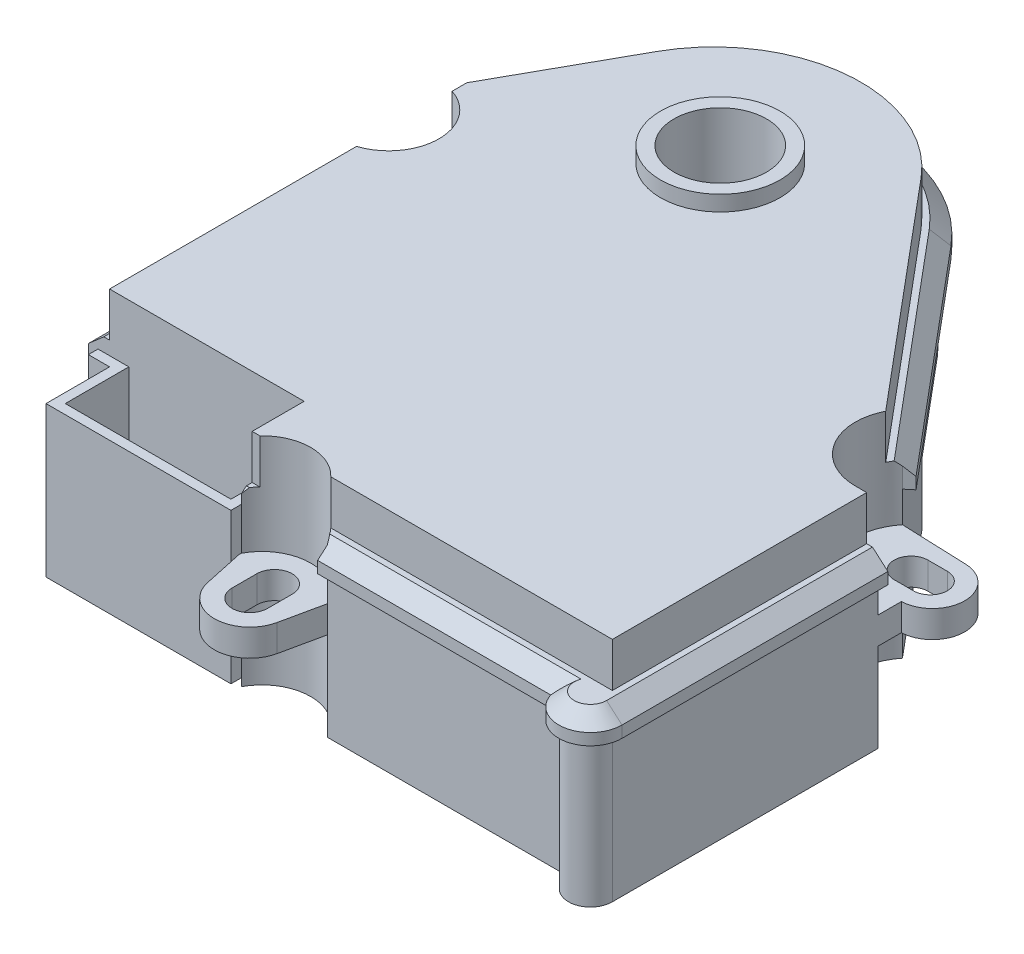
from build123d import *
from OCP.BRepFilletAPI import BRepFilletAPI_MakeChamfer

# Parameters (mm, degrees)
BOSS_EXTRUDE1_DEPTH  = 28
BOSS_EXTRUDE2_DEPTH  = 30
BOSS_EXTRUDE3_START  = -6
BOSS_EXTRUDE3_DEPTH  = 6
CUT_EXTRUDE1_DEPTH   = 8
CUT_EXTRUDE2_DEPTH   = 76.67816726110647
BOSS_EXTRUDE4_START  = -13
BOSS_EXTRUDE4_DEPTH  = 3.5
CUT_EXTRUDE4_DEPTH   = 76.67816726110647
BOSS_EXTRUDE5_START  = -13
SKETCH3_3_R          = 2.599999999999996
BOSS_EXTRUDE5_DEPTH  = 3.5
CUT_EXTRUDE5_DEPTH   = 76.67816726110647
BOSS_EXTRUDE6_START  = -13
BOSS_EXTRUDE6_DEPTH  = 3.5
CUT_EXTRUDE6_DEPTH   = 5.75
BOSS_EXTRUDE8_DEPTH  = 3.25
CHAMFER1_SIZE        = 1.75
CHAMFER1_SIZE2       = 2
BOSS_EXTRUDE9_DEPTH  = 12.5
SKETCH9_R            = 5.999999999999998
SKETCH9_R_2          = 5.000000000000008
BOSS_EXTRUDE10_DEPTH = 5
BOSS_EXTRUDE11_DEPTH = 25
CUT_EXTRUDE7_START   = 20.5
SKETCH10_3_W         = 2.749999999999993
SKETCH10_3_H         = 1.25
SKETCH10_3_W_2       = 1.25
CUT_EXTRUDE7_DEPTH   = 7.5
SKETCH10_4_W         = 1.25
SKETCH10_4_H         = 1.25
CUT_EXTRUDE8_DEPTH   = 78.13266949990349
SKETCH11_W           = 24
SKETCH11_H           = 8.25
CUT_EXTRUDE10_DEPTH  = 1
SKETCH12_W           = 21.5
SKETCH12_H           = 8.25
CUT_EXTRUDE11_DEPTH  = 15


with BuildPart() as part:
    # Sketch1 → Boss-Extrude1 (new body)
    with BuildSketch(Plane(origin=(0, 0, 0), x_dir=(1, 0, 0), z_dir=(0, 1, 0))):
        with BuildLine():
            Line((-25.662208655272856, 43.65794838986857), (-30.756279219672532, 34.5))
            Line((-30.756279219672532, 34.5), (-15.400000000000006, 34.500000000000014))
            ThreePointArc((-15.400000000000006, 34.50000000000003), (-13.130077554195768, 39.98007755419575), (-7.65000000000006, 42.25000000000003))
            Line((-7.650000000000004, 42.25000000000003), (-7.650000000000004, 54.25000000000001))
            ThreePointArc((-7.650000000000002, 54.25000000000006), (-18.097861239899487, 51.40573965924003), (-25.662208655272856, 43.65794838986857))
        make_face()
        with BuildLine():
            ThreePointArc((8.139146924334142, 46.8873998734486), (1.060698037782414, 52.31888473712936), (-7.650000000000002, 54.25000000000006))
            Line((-7.650000000000004, 54.25000000000001), (-7.650000000000004, 42.25000000000003))
            ThreePointArc((-7.65000000000006, 42.25000000000003), (-2.1699224458042794, 39.980077554195795), (0.09999999999999876, 34.50000000000003))
            Line((0.09999999999999787, 34.50000000000003), (18.533409589390377, 34.50000000000004))
            Line((18.533409589390406, 34.50000000000007), (8.139146924334142, 46.8873998734486))
        make_face()
        with BuildLine():
            Line((-30.756279219672532, 34.5), (-34.65, 27.5))
            Line((-34.65, 27.5), (-34.65, -27.5))
            Line((-34.65, -27.5), (34.649999999999984, -27.5))
            ThreePointArc((34.64999999999999, -27.5), (37.49999999999999, -30.349999999999994), (40.349999999999994, -27.5))
            Line((40.349999999999994, -27.5), (40.349999999999994, 8.499999999999993))
            Line((40.349999999999994, 8.499999999999993), (18.533409589390406, 34.50000000000007))
            Line((18.533409589390377, 34.50000000000004), (0.09999999999999787, 34.50000000000003))
            ThreePointArc((0.09999999999999876, 34.50000000000003), (-7.650000000000006, 26.750000000000025), (-15.400000000000006, 34.50000000000003))
            Line((-15.400000000000006, 34.500000000000014), (-30.756279219672532, 34.5))
        make_face()
    extrude(amount=BOSS_EXTRUDE1_DEPTH)

    # Sketch1<3> → Boss-Extrude2 (add)
    with BuildSketch(Plane(origin=(0, 0, 0), x_dir=(1, 0, 0), z_dir=(0, 1, 0))):
        with BuildLine():
            ThreePointArc((-7.65000000000006, 42.25000000000003), (-13.130077554195768, 39.98007755419575), (-15.400000000000006, 34.50000000000003))
            Line((-15.400000000000006, 34.500000000000014), (-13.650000000000002, 34.500000000000014))
            ThreePointArc((-13.650000000000002, 34.50000000000003), (-11.892640687119265, 38.742640687119334), (-7.649999999999938, 40.50000000000003))
            Line((-7.650000000000004, 40.50000000000003), (-7.650000000000004, 42.25000000000003))
        make_face()
        with BuildLine():
            ThreePointArc((0.09999999999999876, 34.50000000000003), (-2.1699224458042794, 39.980077554195795), (-7.65000000000006, 42.25000000000003))
            Line((-7.650000000000004, 42.25000000000003), (-7.650000000000004, 40.50000000000003))
            ThreePointArc((-7.649999999999937, 40.50000000000003), (-3.407359312880696, 38.74264068711929), (-1.6500000000000048, 34.50000000000003))
            Line((-1.6500000000000057, 34.50000000000003), (0.09999999999999787, 34.50000000000003))
        make_face()
        with BuildLine():
            Line((-13.650000000000002, 34.500000000000014), (-15.400000000000006, 34.500000000000014))
            ThreePointArc((-15.400000000000006, 34.50000000000003), (-7.650000000000006, 26.750000000000025), (0.09999999999999876, 34.50000000000003))
            Line((0.09999999999999787, 34.50000000000003), (-1.6500000000000057, 34.50000000000003))
            ThreePointArc((-1.6500000000000048, 34.50000000000003), (-7.650000000000005, 28.50000000000003), (-13.650000000000002, 34.50000000000003))
        make_face()
    extrude(amount=BOSS_EXTRUDE2_DEPTH)

    # Sketch1<4> → Boss-Extrude3 (add)
    with BuildSketch(Plane(origin=(0, 0, 0), x_dir=(1, 0, 0), z_dir=(0, 1, 0)).offset(BOSS_EXTRUDE3_START)):
        with BuildLine():
            ThreePointArc((-7.65000000000006, 42.25000000000003), (-13.130077554195768, 39.98007755419575), (-15.400000000000006, 34.50000000000003))
            Line((-15.400000000000006, 34.500000000000014), (-13.650000000000002, 34.500000000000014))
            ThreePointArc((-13.650000000000002, 34.50000000000003), (-11.892640687119265, 38.742640687119334), (-7.649999999999938, 40.50000000000003))
            Line((-7.650000000000004, 40.50000000000003), (-7.650000000000004, 42.25000000000003))
        make_face()
        with BuildLine():
            ThreePointArc((0.09999999999999876, 34.50000000000003), (-2.1699224458042794, 39.980077554195795), (-7.65000000000006, 42.25000000000003))
            Line((-7.650000000000004, 42.25000000000003), (-7.650000000000004, 40.50000000000003))
            ThreePointArc((-7.649999999999937, 40.50000000000003), (-3.407359312880696, 38.74264068711929), (-1.6500000000000048, 34.50000000000003))
            Line((-1.6500000000000057, 34.50000000000003), (0.09999999999999787, 34.50000000000003))
        make_face()
        with BuildLine():
            Line((-13.650000000000002, 34.500000000000014), (-15.400000000000006, 34.500000000000014))
            ThreePointArc((-15.400000000000006, 34.50000000000003), (-7.650000000000006, 26.750000000000025), (0.09999999999999876, 34.50000000000003))
            Line((0.09999999999999787, 34.50000000000003), (-1.6500000000000057, 34.50000000000003))
            ThreePointArc((-1.6500000000000048, 34.50000000000003), (-7.650000000000005, 28.50000000000003), (-13.650000000000002, 34.50000000000003))
        make_face()
    extrude(amount=BOSS_EXTRUDE3_DEPTH)

    # Sketch1<5> → Cut-Extrude1 (cut)
    with BuildSketch(Plane(origin=(0, 0, 0), x_dir=(1, 0, 0), z_dir=(0, 1, 0))):
        with BuildLine():
            Line((-25.662208655272856, 43.65794838986857), (-30.756279219672532, 34.5))
            Line((-30.756279219672532, 34.5), (-15.400000000000006, 34.500000000000014))
            ThreePointArc((-15.400000000000006, 34.50000000000003), (-13.130077554195768, 39.98007755419575), (-7.65000000000006, 42.25000000000003))
            Line((-7.650000000000004, 42.25000000000003), (-7.650000000000004, 54.25000000000001))
            ThreePointArc((-7.650000000000002, 54.25000000000006), (-18.097861239899487, 51.40573965924003), (-25.662208655272856, 43.65794838986857))
        make_face()
        with BuildLine():
            ThreePointArc((8.139146924334142, 46.8873998734486), (1.060698037782414, 52.31888473712936), (-7.650000000000002, 54.25000000000006))
            Line((-7.650000000000004, 54.25000000000001), (-7.650000000000004, 42.25000000000003))
            ThreePointArc((-7.65000000000006, 42.25000000000003), (-2.1699224458042794, 39.980077554195795), (0.09999999999999876, 34.50000000000003))
            Line((0.09999999999999787, 34.50000000000003), (18.533409589390377, 34.50000000000004))
            Line((18.533409589390406, 34.50000000000007), (8.139146924334142, 46.8873998734486))
        make_face()
    extrude(amount=CUT_EXTRUDE1_DEPTH, mode=Mode.SUBTRACT)

    # Sketch2 → Cut-Extrude2 (cut, through all)
    with BuildSketch(Plane(origin=(0, 28, 0), x_dir=(1, 0, 0), z_dir=(0, 1, 0))):
        with BuildLine():
            ThreePointArc((3.3500000000000005, -27.5), (-2.3000000000000003, -23.999999999999996), (-7.950000000000002, -27.5))
            Line((-7.950000000000003, -27.5), (-4.26214168703477, -27.5))
            ThreePointArc((-4.262141687034803, -27.499999999999904), (-2.300000000000004, -26.4), (-0.3378583129652024, -27.4999999999999))
            Line((-0.3378583129652384, -27.5), (3.3500000000000014, -27.5))
        make_face()
        with BuildLine():
            ThreePointArc((-0.3378583129652024, -27.4999999999999), (-2.300000000000004, -26.4), (-4.262141687034803, -27.499999999999904))
            Line((-4.26214168703477, -27.5), (-0.3378583129652384, -27.5))
        make_face()
    extrude(amount=-CUT_EXTRUDE2_DEPTH, mode=Mode.SUBTRACT)

    # Sketch2<3> → Boss-Extrude4 (add)
    with BuildSketch(Plane(origin=(0, 28, 0), x_dir=(1, 0, 0), z_dir=(0, 1, 0)).offset(BOSS_EXTRUDE4_START)):
        with BuildLine():
            Line((-7.950000000000002, -27.5), (-6.797424116904999, -32.86601051375299))
            ThreePointArc((-6.797424116904999, -32.86601051375299), (-2.300000000000003, -36.49999999999999), (2.1974241169049953, -32.86601051375299))
            Line((2.1974241169049953, -32.86601051375299), (3.3499999999999988, -27.5))
            ThreePointArc((3.3499999999999988, -27.5), (-2.3000000000000025, -23.999999999999996), (-7.950000000000002, -27.5))
        make_face()
        with BuildLine():
            Line((-4.600000000000002, -28.7), (-4.600000000000001, -31.89999999999999))
            ThreePointArc((-4.600000000000001, -31.89999999999999), (-2.300000000000004, -34.19999999999999), (-1.73e-15, -31.89999999999999))
            Line((-1.73e-15, -31.89999999999999), (-8.7e-16, -28.7))
            ThreePointArc((-8.7e-16, -28.7), (-2.3000000000000025, -26.4), (-4.600000000000002, -28.7))
        make_face(mode=Mode.SUBTRACT)
    extrude(amount=-BOSS_EXTRUDE4_DEPTH)

    # Sketch3 → Cut-Extrude4 (cut, through all)
    with BuildSketch(Plane(origin=(0, 28, 0), x_dir=(1, 0, 0), z_dir=(0, 1, 0))):
        with BuildLine():
            Line((-34.65, 16.40770372063687), (-34.65, 21.59229627936313))
            ThreePointArc((-34.649999999999935, 21.592296279363136), (-37.449999999999996, 19), (-34.649999999999935, 16.407703720636864))
        make_face()
        with BuildLine():
            ThreePointArc((-32.25000000000001, 19), (-32.94212159716609, 20.766352173265542), (-34.649999999999935, 21.592296279363136))
            Line((-34.65, 21.59229627936313), (-34.65, 16.40770372063687))
            ThreePointArc((-34.649999999999935, 16.407703720636864), (-32.94212159716609, 17.233647826734458), (-32.25000000000001, 19))
        make_face()
        with BuildLine():
            ThreePointArc((-34.64999999999999, 12.500000000000004), (-28.65, 19.000000000000007), (-34.65, 25.500000000000007))
            Line((-34.65, 25.500000000000007), (-34.65, 21.59229627936313))
            ThreePointArc((-34.649999999999935, 21.592296279363136), (-32.94212159716609, 20.766352173265542), (-32.25000000000001, 19))
            ThreePointArc((-32.25000000000001, 19), (-32.94212159716609, 17.233647826734458), (-34.649999999999935, 16.407703720636864))
            Line((-34.65, 16.40770372063687), (-34.65, 12.500000000000004))
        make_face()
    extrude(amount=-CUT_EXTRUDE4_DEPTH, mode=Mode.SUBTRACT)

    # Sketch3<3> → Boss-Extrude5 (add)
    with BuildSketch(Plane(origin=(0, 28, 0), x_dir=(1, 0, 0), z_dir=(0, 1, 0)).offset(BOSS_EXTRUDE5_START)):
        with BuildLine():
            Line((-34.65, 25.500000000000004), (-37.97796037936432, 22.640860319365068))
            ThreePointArc((-37.97796037936432, 22.640860319365068), (-39.650000000000006, 19.00000000000001), (-37.97796037936433, 15.359139680634947))
            Line((-37.97796037936433, 15.359139680634947), (-34.64999999999999, 12.500000000000002))
            ThreePointArc((-34.64999999999999, 12.500000000000002), (-28.65, 19.000000000000007), (-34.65, 25.500000000000004))
        make_face()
        with Locations(Location((-34.85, 19, 0), (0, 0, 270))):
            Circle(SKETCH3_3_R, mode=Mode.SUBTRACT)
    extrude(amount=-BOSS_EXTRUDE5_DEPTH)

    # Sketch4 → Cut-Extrude5 (cut, through all)
    with BuildSketch(Plane(origin=(0, 28, 0), x_dir=(1, 0, 0), z_dir=(0, 1, 0))):
        with BuildLine():
            Line((37.375925518353405, 7), (40.349999999999994, 6.999999999999997))
            Line((40.349999999999994, 6.999999999999997), (40.349999999999994, 9.999999999999996))
            ThreePointArc((40.349999999999994, 9.999999999999996), (44.3756544084855, 14.185099364674413), (40.349999999999994, 18.370198729348825))
            Line((40.349999999999994, 18.370198729348825), (31.788813985248318, 18.702824189947503))
            ThreePointArc((31.788813985248318, 18.702824189947503), (30.891869895053734, 11.089509670577248), (37.375925518353405, 7))
        make_face()
        with BuildLine():
            Line((37.425654408485485, 16.385099364674414), (39.92565440848548, 16.385099364674414))
            ThreePointArc((39.92565440848548, 16.385099364674414), (42.12565440848548, 14.185099364674413), (39.92565440848548, 11.985099364674412))
            Line((39.92565440848548, 11.985099364674412), (37.425654408485485, 11.985099364674413))
            ThreePointArc((37.425654408485485, 11.985099364674413), (35.22565440848548, 14.185099364674413), (37.425654408485485, 16.385099364674414))
        make_face(mode=Mode.SUBTRACT)
    extrude(amount=-CUT_EXTRUDE5_DEPTH, mode=Mode.SUBTRACT)


with BuildPart() as cut_extrude5_kept_piece:
    # of the separate pieces the step leaves, the one the design keeps (cut_extrude5_pieces_kept)
    add(part.part.solids().sort_by_distance((-25.662208655, 8, -43.65794839))[0])

    # Sketch4<3> → Boss-Extrude6 (add)
    with BuildSketch(Plane(origin=(0, 28, 0), x_dir=(1, 0, 0), z_dir=(0, 1, 0)).offset(BOSS_EXTRUDE6_START)):
        with BuildLine():
            Line((37.375925518353405, 7), (40.349999999999994, 6.999999999999997))
            Line((40.349999999999994, 6.999999999999997), (40.349999999999994, 9.999999999999996))
            ThreePointArc((40.349999999999994, 9.999999999999996), (44.3756544084855, 14.185099364674413), (40.349999999999994, 18.370198729348825))
            Line((40.349999999999994, 18.370198729348825), (31.788813985248318, 18.702824189947503))
            ThreePointArc((31.788813985248318, 18.702824189947503), (30.891869895053734, 11.089509670577248), (37.375925518353405, 7))
        make_face()
        with BuildLine():
            Line((37.425654408485485, 16.385099364674414), (39.92565440848548, 16.385099364674414))
            ThreePointArc((39.92565440848548, 16.385099364674414), (42.12565440848548, 14.185099364674413), (39.92565440848548, 11.985099364674412))
            Line((39.92565440848548, 11.985099364674412), (37.425654408485485, 11.985099364674413))
            ThreePointArc((37.425654408485485, 11.985099364674413), (35.22565440848548, 14.185099364674413), (37.425654408485485, 16.385099364674414))
        make_face(mode=Mode.SUBTRACT)
    extrude(amount=-BOSS_EXTRUDE6_DEPTH)

    # Sketch6 → Cut-Extrude6 (cut)
    with BuildSketch(Plane(origin=(0, 28, 0), x_dir=(1, 0, 0), z_dir=(0, 1, 0))):
        with BuildLine():
            Line((-26.53610972255631, 44.14405221067313), (-35.65, 27.759407409116456))
            Line((-35.65, 27.759407409116456), (-35.65, -28.5))
            Line((-35.65, -28.5), (33.78213771099574, -28.5))
            ThreePointArc((33.78213771099574, -28.5), (38.00434620417606, -31.316822619186432), (41.349999999999994, -27.5))
            Line((41.349999999999994, -27.5), (41.349999999999994, 8.863970234266196))
            Line((41.349999999999994, 8.863970234266196), (8.90519136745315, 47.53018748313516))
            ThreePointArc((8.90519136745315, 47.53018748313516), (-9.705425288204877, 55.152033265774875), (-26.53610972255631, 44.14405221067313))
        make_face()
        with BuildLine():
            Line((38.849999999999994, -25.999999999999996), (38.849999999999994, 7.9540446486006875))
            Line((38.849999999999994, 7.9540446486006875), (6.990080259655714, 45.92321845891881))
            ThreePointArc((6.990080259655714, 45.92321845891881), (-9.467652875109875, 52.66336609647101), (-24.351357054347616, 42.9287926586617))
            Line((-24.351357054347616, 42.9287926586617), (-33.15, 27.110888886325302))
            Line((-33.15, 27.110888886325302), (-33.15, -26.000000000000004))
            Line((-33.15, -26.000000000000004), (33.78213771099574, -26))
            Line((33.78213771099574, -26), (38.849999999999994, -25.999999999999996))
        make_face(mode=Mode.SUBTRACT)
    extrude(amount=-CUT_EXTRUDE6_DEPTH, mode=Mode.SUBTRACT)

    # Sketch7 → Boss-Extrude8 (add)
    with BuildSketch(Plane(origin=(0, 22.25, 0), x_dir=(1, 0, 0), z_dir=(0, 1, 0))):
        with BuildLine():
            Line((32.74636953914704, 19.506308702055676), (9.096702478232876, 47.690884385556785))
            ThreePointArc((9.096702478232876, 47.690884385556785), (-9.729202529514367, 55.40089998270525), (-26.754584989377168, 44.265578165874274))
            Line((-26.754584989377168, 44.265578165874274), (-35.9, 27.824259261395564))
            Line((-35.9, 27.824259261395564), (-35.9, 25.500000000000004))
            Line((-35.9, 25.500000000000004), (-34.65, 25.500000000000004))
            Line((-34.65, 25.500000000000004), (-34.65, 27.5))
            Line((-34.65, 27.5), (-25.66220865527283, 43.65794838986856))
            ThreePointArc((-25.66220865527283, 43.65794838986856), (-9.610316322966874, 54.1565663980533), (8.139146924334158, 46.8873998734486))
            Line((8.139146924334158, 46.8873998734486), (31.788813985248318, 18.702824189947503))
            Line((31.788813985248318, 18.702824189947503), (32.74636953914704, 19.506308702055676))
        make_face()
        with BuildLine():
            Line((6.990080259655713, 45.92321845891881), (30.940394693151596, 17.380345189039407))
            ThreePointArc((30.940394693151596, 17.380345189039407), (31.328345837530712, 18.064845862107603), (31.788813985248318, 18.702824189947503))
            Line((31.788813985248318, 18.702824189947503), (8.139146924334156, 46.8873998734486))
            ThreePointArc((8.139146924334158, 46.8873998734486), (-9.610316322966874, 54.1565663980533), (-25.662208655272828, 43.65794838986856))
            Line((-25.66220865527283, 43.65794838986856), (-34.65, 27.5))
            Line((-34.65, 27.5), (-34.65, 25.500000000000004))
            ThreePointArc((-34.65, 25.500000000000007), (-33.8911663400493, 25.39403782811852), (-33.15, 25.199798383818628))
            Line((-33.15, 25.199798383818624), (-33.15, 27.110888886325302))
            Line((-33.15, 27.110888886325302), (-24.35135705434762, 42.9287926586617))
            ThreePointArc((-24.351357054347613, 42.928792658661706), (-9.46765287510987, 52.66336609647101), (6.990080259655712, 45.92321845891881))
        make_face()
        with BuildLine():
            Line((3.349999999999998, -28.750000000000004), (33.595195267366115, -28.75))
            ThreePointArc((33.595195267366115, -28.75), (38.132574341955575, -31.550907268983018), (41.6, -27.5))
            Line((41.6, -27.5), (41.6, 6.999999999999996))
            Line((41.6, 6.999999999999996), (40.349999999999994, 6.999999999999997))
            Line((40.349999999999994, 6.999999999999997), (40.349999999999994, -27.5))
            ThreePointArc((40.349999999999994, -27.5), (37.5, -30.35), (34.65, -27.5))
            Line((34.65, -27.5), (3.3499999999999988, -27.5))
            Line((3.3499999999999988, -27.5), (3.349999999999998, -28.750000000000004))
        make_face()
        with BuildLine():
            Line((38.849999999999994, -25.999999999999996), (2.3088424329140156, -26.00000000000002))
            ThreePointArc((2.308842432914015, -26.00000000000002), (2.88396199984522, -26.712142967107052), (3.3499999999999988, -27.5))
            Line((3.3499999999999988, -27.5), (34.65, -27.5))
            ThreePointArc((34.650000000000006, -27.5), (37.5, -30.350000000000005), (40.349999999999994, -27.5))
            Line((40.349999999999994, -27.5), (40.349999999999994, 7))
            Line((40.349999999999994, 6.999999999999997), (38.849999999999994, 6.999999999999999))
            Line((38.849999999999994, 6.9999999999999964), (38.849999999999994, -25.999999999999996))
        make_face()
        with BuildLine():
            ThreePointArc((-33.15, 12.800201616181381), (-33.8911663400493, 12.605962171881488), (-34.65, 12.500000000000005))
            Line((-34.65, 12.500000000000005), (-34.65, -27.5))
            Line((-34.65, -27.5), (-7.949999999999998, -27.5))
            ThreePointArc((-7.949999999999998, -27.5), (-7.483961999845218, -26.71214296710705), (-6.908842432914023, -26.000000000000004))
            Line((-6.908842432914023, -26.000000000000004), (-33.15, -26.000000000000004))
            Line((-33.15, -26.000000000000004), (-33.15, 12.800201616181381))
        make_face()
        Polygon((-35.89999999999999, -28.750000000000007), (-7.950000000000002, -28.75), (-7.950000000000002, -27.5), (-34.65, -27.5), (-34.65, 12.500000000000002), (-35.9, 12.500000000000002), align=None)
    extrude(amount=-BOSS_EXTRUDE8_DEPTH)

    # Chamfer1: one chamfer whose edges measure the first distance from different faces: ONE call of the kernel's chamfer builder (chamfer() names one face for all edges)
    chamfer1_edges_1 = [cut_extrude5_kept_piece.edges().sort_by_distance(p)[0] for p in [
        (18.47259763368306, 22.25, 28.750000000000004),
    ]]
    chamfer1_side_1 = [cut_extrude5_kept_piece.faces().sort_by_distance(p)[0] for p in [
        (18.472597633683055, 20.625, 28.749999999999996),
    ]]
    chamfer1_edges_2 = [cut_extrude5_kept_piece.edges().sort_by_distance(p)[0] for p in [
        (38.132574341955575, 22.25, 31.550907268983018),
    ]]
    chamfer1_side_2 = [cut_extrude5_kept_piece.faces().sort_by_distance(p)[0] for p in [
        (38.132574341955575, 20.625, 31.550907268983018),
    ]]
    chamfer1_edges_3 = [cut_extrude5_kept_piece.edges().sort_by_distance(p)[0] for p in [
        (41.6, 22.25, 10.250000000000004),
    ]]
    chamfer1_side_3 = [cut_extrude5_kept_piece.faces().sort_by_distance(p)[0] for p in [
        (41.6, 20.625, 10.250000000000004),
    ]]
    chamfer1_edges_4 = [cut_extrude5_kept_piece.edges().sort_by_distance(p)[0] for p in [
        (20.92153600868996, 22.25, -33.59859654380623),
    ]]
    chamfer1_side_4 = [cut_extrude5_kept_piece.faces().sort_by_distance(p)[0] for p in [
        (20.92153600868996, 20.624999999999996, -33.59859654380623),
    ]]
    chamfer1_edges_5 = [cut_extrude5_kept_piece.edges().sort_by_distance(p)[0] for p in [
        (-9.729202529514374, 22.25, -55.40089998270525),
    ]]
    chamfer1_side_5 = [cut_extrude5_kept_piece.faces().sort_by_distance(p)[0] for p in [
        (-9.729202529514374, 20.625, -55.40089998270525),
    ]]
    chamfer1_edges_6 = [cut_extrude5_kept_piece.edges().sort_by_distance(p)[0] for p in [
        (-31.327292494688585, 22.25, -36.04491871363492),
    ]]
    chamfer1_side_6 = [cut_extrude5_kept_piece.faces().sort_by_distance(p)[0] for p in [
        (-31.327292494688585, 20.625, -36.04491871363492),
    ]]
    chamfer1_edges_7 = [cut_extrude5_kept_piece.edges().sort_by_distance(p)[0] for p in [
        (-35.9, 22.25, -26.662129630697784),
    ]]
    chamfer1_side_7 = [cut_extrude5_kept_piece.faces().sort_by_distance(p)[0] for p in [
        (-35.9, 20.625, -26.662129630697784),
    ]]
    chamfer1_edges_8 = [cut_extrude5_kept_piece.edges().sort_by_distance(p)[0] for p in [
        (-21.924999999999997, 22.25, 28.750000000000004),
    ]]
    chamfer1_side_8 = [cut_extrude5_kept_piece.faces().sort_by_distance(p)[0] for p in [
        (-21.924999999999997, 20.625, 28.75),
    ]]
    chamfer1_edges_9 = [cut_extrude5_kept_piece.edges().sort_by_distance(p)[0] for p in [
        (-35.89999999999999, 22.25, 8.125000000000002),
    ]]
    chamfer1_side_9 = [cut_extrude5_kept_piece.faces().sort_by_distance(p)[0] for p in [
        (-35.89999999999999, 20.625, 8.125000000000002),
    ]]
    chamfer1 = BRepFilletAPI_MakeChamfer(cut_extrude5_kept_piece.part.solid().wrapped)
    for e in chamfer1_edges_1:
        chamfer1.Add(CHAMFER1_SIZE, CHAMFER1_SIZE2, e.wrapped, chamfer1_side_1[0].wrapped)  # the first distance lies on this face
    for e in chamfer1_edges_2:
        chamfer1.Add(CHAMFER1_SIZE, CHAMFER1_SIZE2, e.wrapped, chamfer1_side_2[0].wrapped)  # the first distance lies on this face
    for e in chamfer1_edges_3:
        chamfer1.Add(CHAMFER1_SIZE, CHAMFER1_SIZE2, e.wrapped, chamfer1_side_3[0].wrapped)  # the first distance lies on this face
    for e in chamfer1_edges_4:
        chamfer1.Add(CHAMFER1_SIZE, CHAMFER1_SIZE2, e.wrapped, chamfer1_side_4[0].wrapped)  # the first distance lies on this face
    for e in chamfer1_edges_5:
        chamfer1.Add(CHAMFER1_SIZE, CHAMFER1_SIZE2, e.wrapped, chamfer1_side_5[0].wrapped)  # the first distance lies on this face
    for e in chamfer1_edges_6:
        chamfer1.Add(CHAMFER1_SIZE, CHAMFER1_SIZE2, e.wrapped, chamfer1_side_6[0].wrapped)  # the first distance lies on this face
    for e in chamfer1_edges_7:
        chamfer1.Add(CHAMFER1_SIZE, CHAMFER1_SIZE2, e.wrapped, chamfer1_side_7[0].wrapped)  # the first distance lies on this face
    for e in chamfer1_edges_8:
        chamfer1.Add(CHAMFER1_SIZE, CHAMFER1_SIZE2, e.wrapped, chamfer1_side_8[0].wrapped)  # the first distance lies on this face
    for e in chamfer1_edges_9:
        chamfer1.Add(CHAMFER1_SIZE, CHAMFER1_SIZE2, e.wrapped, chamfer1_side_9[0].wrapped)  # the first distance lies on this face
    add(Compound.cast(chamfer1.Shape()), mode=Mode.REPLACE)

    # Sketch8 → Boss-Extrude9 (add)
    with BuildSketch(Plane.XZ.offset(6)):
        with BuildLine():
            Line((-10.96662479035539, -29.50000000000002), (-4.333375209644614, -29.500000000000025))
            ThreePointArc((-4.333375209644614, -29.500000000000025), (-7.650000000000001, -28.50000000000003), (-10.96662479035539, -29.50000000000002))
        make_face()
        with BuildLine():
            Line((-10.96662479035539, -39.500000000000036), (-4.333375209644614, -39.500000000000036))
            ThreePointArc((-4.333375209644614, -39.500000000000036), (-7.650000000000002, -40.50000000000003), (-10.96662479035539, -39.500000000000036))
        make_face()
    extrude(amount=-BOSS_EXTRUDE9_DEPTH)

    # Sketch9 → Boss-Extrude10 (add)
    with BuildSketch(Plane(origin=(0, 6.500000000000001, 0), x_dir=(1, 0, 0), z_dir=(0, 1, 0))):
        with Locations(Location((-7.650000000000004, 34.50000000000003, 0), (0, 0, 270))):
            Circle(SKETCH9_R)
        with Locations(Location((-7.650000000000004, 34.50000000000003, 0), (0, 0, 270))):
            Circle(SKETCH9_R_2, mode=Mode.SUBTRACT)
    extrude(amount=BOSS_EXTRUDE10_DEPTH)

    # Sketch10 → Boss-Extrude11 (add)
    with BuildSketch(Plane(origin=(0, 0, 0), x_dir=(1, 0, 0), z_dir=(0, 1, 0))):
        Polygon((-7.899999999999998, -19.250000000000004), (-7.899999999999996, -28.75), (-31.9, -28.75), (-31.9, -19.250000000000004), align=None)
    extrude(amount=BOSS_EXTRUDE11_DEPTH)

    # Sketch10<3> → Cut-Extrude7 (cut)
    with BuildSketch(Plane(origin=(0, 0, 0), x_dir=(1, 0, 0), z_dir=(0, 1, 0)).offset(CUT_EXTRUDE7_START)):
        Polygon((-7.899999999999999, -19.250000000000004), (-31.9, -19.250000000000004), (-31.9, -20.500000000000004), (-31.9, -28.75), (-7.899999999999995, -28.75), align=None)
        with Locations((-33.27499999999999, -19.875000000000004)):
            Rectangle(SKETCH10_3_W, SKETCH10_3_H)
        Polygon((-31.9, -28.75), (-31.9, -20.500000000000004), (-34.64999999999999, -20.500000000000004), (-35.89999999999999, -20.500000000000004), (-35.89999999999999, -28.75), align=None)
        with Locations((-35.27499999999999, -19.875000000000004)):
            Rectangle(SKETCH10_3_W_2, SKETCH10_3_H)
    extrude(amount=CUT_EXTRUDE7_DEPTH, mode=Mode.SUBTRACT)

    # Sketch10<4> → Cut-Extrude8 (cut, through all)
    with BuildSketch(Plane(origin=(0, 0, 0), x_dir=(1, 0, 0), z_dir=(0, 1, 0))):
        Polygon((-31.9, -28.75), (-31.9, -20.500000000000004), (-34.64999999999999, -20.500000000000004), (-35.89999999999999, -20.500000000000004), (-35.89999999999999, -28.75), align=None)
        with Locations((-35.27499999999999, -19.875000000000004)):
            Rectangle(SKETCH10_4_W, SKETCH10_4_H)
    extrude(amount=CUT_EXTRUDE8_DEPTH, mode=Mode.SUBTRACT)

    # Sketch11 → Cut-Extrude10 (cut)
    with BuildSketch(Plane.XZ):
        with Locations((-19.9, 24.625000000000004)):
            Rectangle(SKETCH11_W, SKETCH11_H)
    extrude(amount=-CUT_EXTRUDE10_DEPTH, mode=Mode.SUBTRACT)

    # Sketch12 → Cut-Extrude11 (cut)
    with BuildSketch(Plane(origin=(0, 20.5, 0), x_dir=(1, 0, 0), z_dir=(0, 1, 0))):
        with Locations((-19.9, -23.375000000000004)):
            Rectangle(SKETCH12_W, SKETCH12_H)
    extrude(amount=-CUT_EXTRUDE11_DEPTH, mode=Mode.SUBTRACT)


solid = cut_extrude5_kept_piece.part
